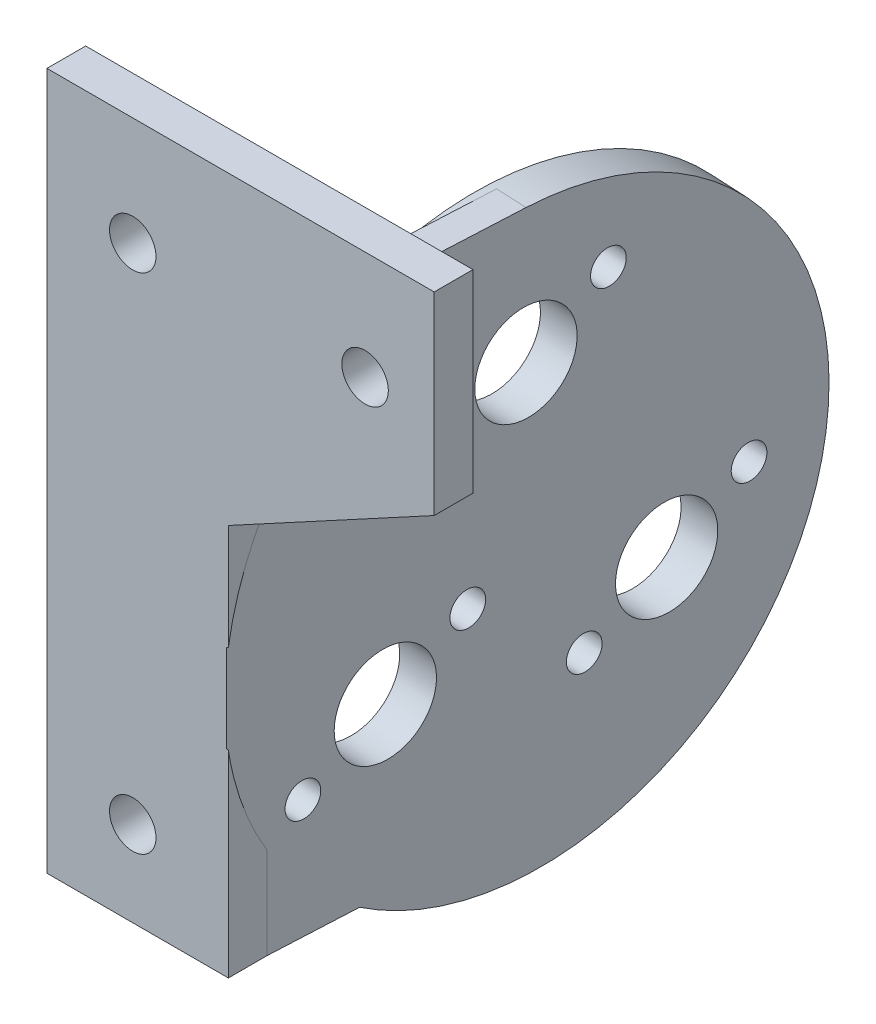
from build123d import *
from build123d.topology import SkipClean

# Parameters (mm, degrees)
SKETCH1_R           = 1.397
SKETCH1_R_2         = 4.0005
BOSS_EXTRUDE1_DEPTH = 3.175
SKETCH2_W           = 31.75
SKETCH2_H           = 57.15
BOSS_EXTRUDE2_DEPTH = 3.175
CUT_EXTRUDE2_DEPTH  = 3.175
CUT_EXTRUDE3_START  = 2.54
SKETCH4_R           = 23.6982
CUT_EXTRUDE3_DEPTH  = 2.54
SKETCH5_W           = 14.873793878
SKETCH5_H           = 32.130520557
CUT_EXTRUDE4_DEPTH  = 2.54
BOSS_EXTRUDE3_DEPTH = 2.54
SKETCH9_R           = 1.905
CUT_EXTRUDE6_DEPTH  = 6.35


with BuildPart() as part:
    # Sketch1 → Boss-Extrude1 (new body)
    # profile 1 of 2: a face of its own
    with BuildSketch(Plane(origin=(250.96748785, 0, 12.493901655), x_dir=(-0.04972137386865806, 0, 0.9987631275635946), z_dir=(-0.9987631275635946, -1.0338951916821772e-15, -0.04972137386865806))):
        with BuildLine():
            ThreePointArc((-0.642468938, 23.635575071), (-7.278200133, -18.075315821), (30.358231062, 1.090549523))
            ThreePointArc((30.358231062, 1.090549523), (25.825896406, 15.028780719), (13.962531062, 23.635575071))
            Line((13.962531062, 23.635575071), (13.962531062, 22.014532559))
            ThreePointArc((13.962531062, 22.014532559), (6.660031062, 2.792349523), (-0.642468938, 22.014532559))
            Line((-0.642468938, 22.014532559), (-0.642468938, 23.635575071))
        make_face()
        with Locations((2.106642694, -8.980550477)):
            Circle(SKETCH1_R, mode=Mode.SUBTRACT)
        with Locations((24.103687951, -8.980550477)):
            Circle(SKETCH1_R, mode=Mode.SUBTRACT)
        with Locations((-10.783625826, -1.538350477)):
            Circle(SKETCH1_R, mode=Mode.SUBTRACT)
        with Locations((-4.338491566, -5.259450477)):
            Circle(SKETCH1_R_2, mode=Mode.SUBTRACT)
        with Locations((17.658553691, -5.259450477)):
            Circle(SKETCH1_R_2, mode=Mode.SUBTRACT)
        with Locations((11.21341943, -1.538350477)):
            Circle(SKETCH1_R, mode=Mode.SUBTRACT)
    # profile 2 of 2: a face of its own
    with BuildSketch(Plane(origin=(250.96748785, 0, 12.493901655), x_dir=(-0.04972137386865806, 0, 0.9987631275635946), z_dir=(-0.9987631275635946, -1.0338951916821772e-15, -0.04972137386865806))):
        with BuildLine():
            Line((13.962531062, 22.014532559), (13.962531062, 23.635575071))
            ThreePointArc((13.962531062, 23.635575071), (6.660031062, 24.788749523), (-0.642468938, 23.635575071))
            Line((-0.642468938, 23.635575071), (-0.642468938, 22.014532559))
            ThreePointArc((-0.642468938, 22.014532559), (6.660031062, 2.792349523), (13.962531062, 22.014532559))
        make_face()
        with Locations((6.660031062, 13.790549523)):
            Circle(SKETCH1_R_2, mode=Mode.SUBTRACT)
        with Locations((0.214896802, 17.511649523)):
            Circle(SKETCH1_R, mode=Mode.SUBTRACT)
        with Locations((13.105165323, 10.069449523)):
            Circle(SKETCH1_R, mode=Mode.SUBTRACT)
    extrude(amount=BOSS_EXTRUDE1_DEPTH)

    # Sketch2 → Boss-Extrude2 (add)
    with BuildSketch(Plane(origin=(0, 0, 42.540622794), x_dir=(-1, 0, 0), z_dir=(0, 0, -1))):
        with Locations((-250.630940448, 9.853549523)):
            Rectangle(SKETCH2_W, SKETCH2_H)
    extrude(amount=BOSS_EXTRUDE2_DEPTH)

    # Sketch3 → Cut-Extrude2 (cut)
    with BuildSketch(Plane(origin=(0, 0, 39.365622794), x_dir=(-1, 0, 0), z_dir=(0, 0, -1))):
        Polygon((-249.629734326, 13.40907008), (-266.505940448, 22.553549523), (-266.505940448, -18.721450477), (-249.629734326, -18.721450477), align=None)
    extrude(amount=-CUT_EXTRUDE2_DEPTH, mode=Mode.SUBTRACT)

    # Sketch4 → Cut-Extrude3 (cut)
    with SkipClean():  # the faces are left unmerged after this step: merging them gives an invalid solid
        with BuildSketch(Plane(origin=(250.96748785, 0, 12.493901655), x_dir=(0.049721373868658096, 0, -0.9987631275635946), z_dir=(0.9987631275635946, 1.3357370765021432e-15, 0.049721373868658096)).offset(CUT_EXTRUDE3_START)):
            with Locations((-6.660031062, 1.090549523)):
                Circle(SKETCH4_R)
        extrude(amount=-CUT_EXTRUDE3_DEPTH, mode=Mode.SUBTRACT)

    # Sketch5 → Cut-Extrude4 (cut)
    with SkipClean():  # the faces are left unmerged after this step: merging them gives an invalid solid
        with BuildSketch(Plane.XY.offset(42.540622794)):
            with Locations((242.192837387, -2.656190199)):
                Rectangle(SKETCH5_W, SKETCH5_H)
        extrude(amount=CUT_EXTRUDE4_DEPTH, mode=Mode.SUBTRACT)

    # Sketch6 → Boss-Extrude3 (add)
    with BuildSketch(Plane(origin=(250.96748785, 0, 12.493901655), x_dir=(0.049721373868658096, 0, -0.9987631275635946), z_dir=(0.9987631275635946, 1.335737076502143e-15, 0.049721373868658096))):
        with BuildLine():
            ThreePointArc((-26.904999191, 13.40907008), (-18.272048961, 21.748858349), (-6.660031062, 24.788749523))
            Line((-6.660031062, 24.788749523), (-30.076072121, 24.788749523))
            Line((-30.076072121, 24.788749523), (-30.076072121, 13.40907008))
            Line((-30.076072121, 13.40907008), (-30.076072121, 4.736602785))
            ThreePointArc((-30.076072121, 4.736602785), (-28.91702666, 9.228782144), (-26.904999191, 13.40907008))
        make_face()
        with BuildLine():
            Line((-30.076072121, -2.55550374), (-30.076072121, -18.721450477))
            Line((-30.076072121, -18.721450477), (-19.663466733, -18.721450477))
            ThreePointArc((-19.663466733, -18.721450477), (-23.70122079, -15.377678552), (-26.904999191, -11.227971035))
            ThreePointArc((-26.904999191, -11.227971035), (-28.91702666, -7.047683098), (-30.076072121, -2.55550374))
        make_face()
    extrude(amount=-BOSS_EXTRUDE3_DEPTH)

    # Sketch9 → Cut-Extrude6 (cut)
    with BuildSketch(Plane.XY.offset(42.540622794)):
        with Locations((260.839665535, 29.538549523)):
            Circle(SKETCH9_R)
        with Locations((241.789665535, 29.538549523)):
            Circle(SKETCH9_R)
        with Locations((241.789665535, -11.736450477)):
            Circle(SKETCH9_R)
    extrude(amount=-CUT_EXTRUDE6_DEPTH, mode=Mode.SUBTRACT)


solid = part.part
